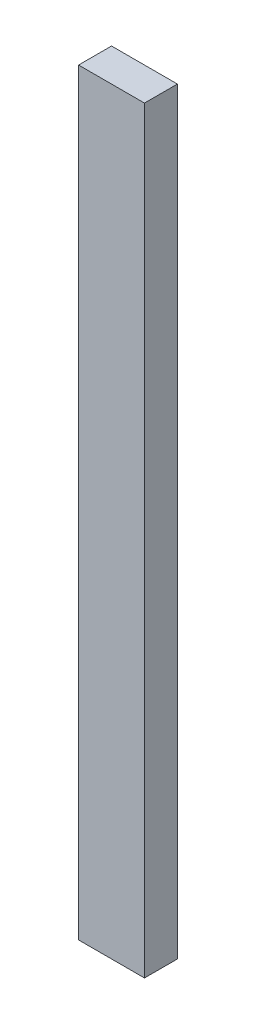
from build123d import *

# Parameters (mm, degrees)
SKETCH1_W           = 25.4
SKETCH1_H           = 12.7
BOSS_EXTRUDE1_DEPTH = 292.1


with BuildPart() as part:
    # Sketch1 → Boss-Extrude1 (new body)
    with BuildSketch(Plane(origin=(0, 0, 0), x_dir=(1, 0, 0), z_dir=(0, 1, 0))):
        with Locations((12.7, 6.35)):
            Rectangle(SKETCH1_W, SKETCH1_H)
    extrude(amount=BOSS_EXTRUDE1_DEPTH)


solid = part.part
